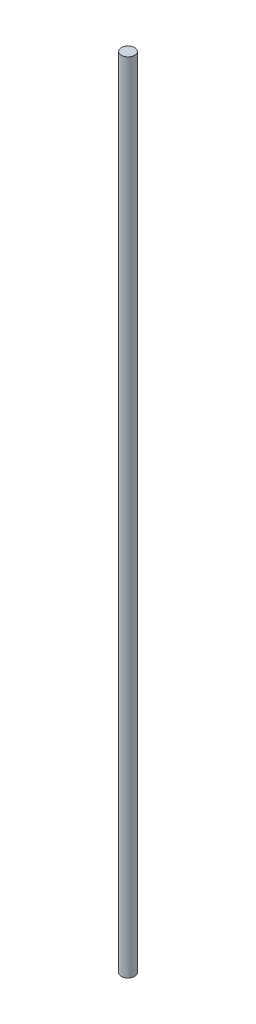
from build123d import *

# Parameters (mm, degrees)
SKETCH1_R           = 4
BOSS_EXTRUDE1_DEPTH = 480


with BuildPart() as part:
    # Sketch1 → Boss-Extrude1 (new body)
    with BuildSketch(Plane(origin=(0, 0, 0), x_dir=(1, 0, 0), z_dir=(0, 1, 0))):
        with Locations(Location((0, 0, 0), (0, 0, 270))):
            Circle(SKETCH1_R)
    extrude(amount=BOSS_EXTRUDE1_DEPTH)


solid = part.part
